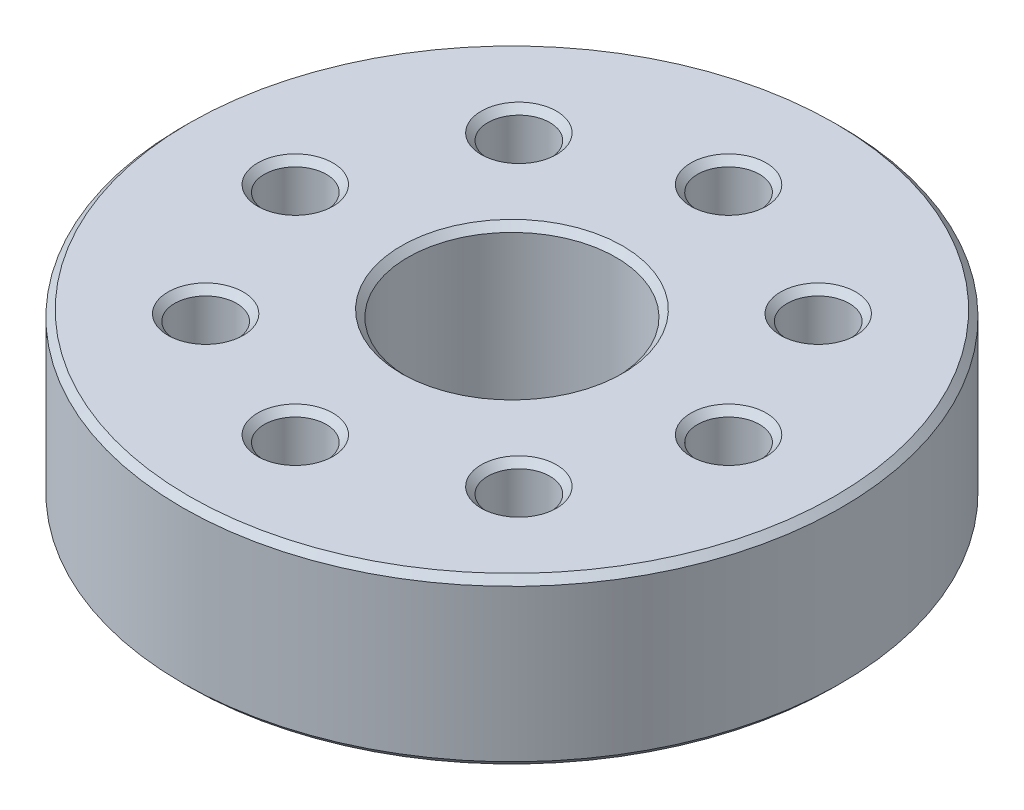
from build123d import *

# Parameters (mm, degrees)
SKETCH1_R           = 12.6746
SKETCH1_R_2         = 4.0005
SKETCH1_R_3         = 1.1938
BOSS_EXTRUDE1_DEPTH = 6.35
CHAMFER1_SIZE       = 0.254


with BuildPart() as part:
    # Sketch1 → Boss-Extrude1 (new body)
    with BuildSketch(Plane(origin=(0, 0, 0), x_dir=(1, 0, 0), z_dir=(0, 1, 0))):
        with Locations(Location((0, 0, 0), (0, 0, 270))):
            Circle(SKETCH1_R)
        with Locations(Location((0, 0, 0), (0, 0, 270))):
            Circle(SKETCH1_R_2, mode=Mode.SUBTRACT)
        with Locations(Location((0, 8.3312, 0), (0, 0, 270))):
            Circle(SKETCH1_R_3, mode=Mode.SUBTRACT)
        with Locations(Location((8.3312, 0, 0), (0, 0, 270))):
            Circle(SKETCH1_R_3, mode=Mode.SUBTRACT)
        with Locations(Location((0, -8.3312, 0), (0, 0, 270))):
            Circle(SKETCH1_R_3, mode=Mode.SUBTRACT)
        with Locations(Location((-8.3312, 0, 0), (0, 0, 270))):
            Circle(SKETCH1_R_3, mode=Mode.SUBTRACT)
        with Locations(Location((-5.756293352, 6.022788415, 0), (0, 0, 270))):
            Circle(SKETCH1_R_3, mode=Mode.SUBTRACT)
        with Locations(Location((6.022788415, 5.756293352, 0), (0, 0, 270))):
            Circle(SKETCH1_R_3, mode=Mode.SUBTRACT)
        with Locations(Location((6.022788415, -5.756293352, 0), (0, 0, 270))):
            Circle(SKETCH1_R_3, mode=Mode.SUBTRACT)
        with Locations(Location((-5.756293352, -6.022788415, 0), (0, 0, 270))):
            Circle(SKETCH1_R_3, mode=Mode.SUBTRACT)
    extrude(amount=BOSS_EXTRUDE1_DEPTH)

    # Chamfer1
    chamfer1_edges = [part.edges().sort_by_distance(p)[0] for p in [
        (8.3312, 0, -1.1938),
        (8.3312, 6.35, -1.1938),
        (0, 0, 7.1374),
        (0, 6.35, 7.1374),
        (0, 0, -12.6746),
        (-8.3312, 0, -1.1938),
        (-8.3312, 6.35, -1.1938),
        (-5.756293352, 0, -7.216588415),
        (-5.756293352, 6.35, -7.216588415),
        (6.022788415, 0, -6.950093352),
        (6.022788415, 6.35, -6.950093352),
        (6.022788415, 0, 4.562493352),
        (6.022788415, 6.35, 4.562493352),
        (-5.756293352, 0, 4.828988415),
        (-5.756293352, 6.35, 4.828988415),
        (0, 6.35, -12.6746),
        (0, 0, -4.0005),
        (0, 6.35, -4.0005),
        (0, 0, -9.525),
        (0, 6.35, -9.525),
    ]]
    chamfer(chamfer1_edges, length=CHAMFER1_SIZE)


solid = part.part
